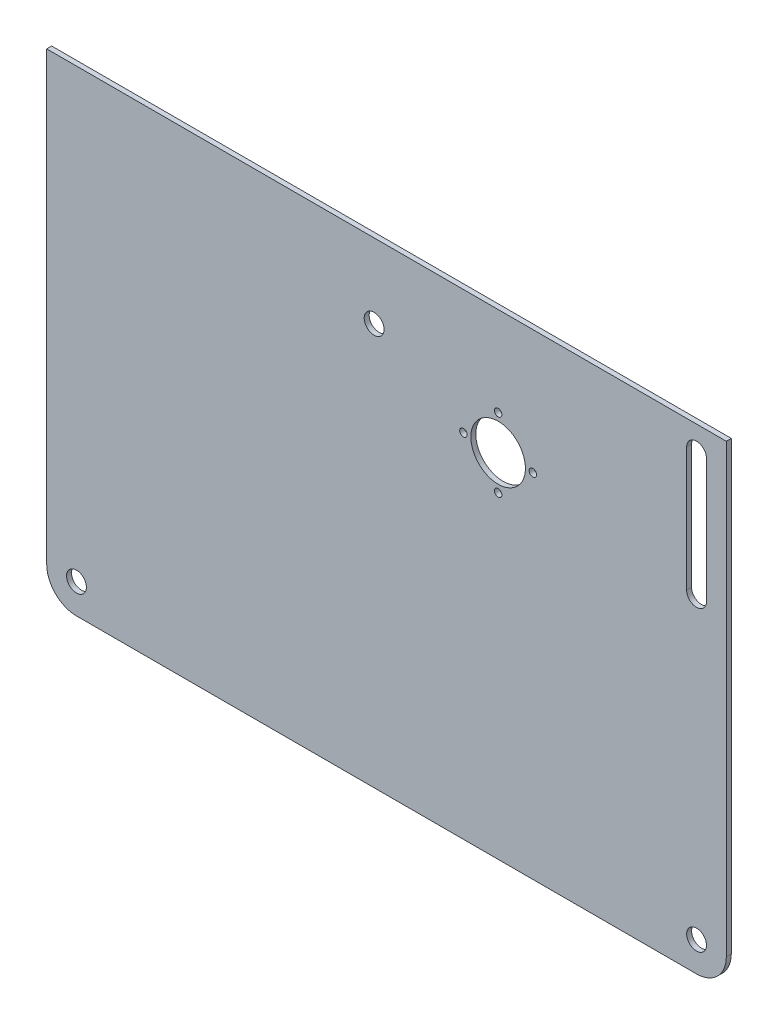
from build123d import *

# Parameters (mm, degrees)
SKETCH1_R           = 4
SKETCH1_R_2         = 1.5
SKETCH1_R_3         = 11
BOSS_EXTRUDE1_DEPTH = 2


with BuildPart() as part:
    # Sketch1 → Boss-Extrude1 (new body)
    with BuildSketch(Plane.XY):
        with BuildLine():
            ThreePointArc((-137, 0), (-133.485281374, -8.485281374), (-125, -12))
            Line((-125, -12), (125, -12))
            ThreePointArc((125, -12), (133.485281374, -8.485281374), (137, 0))
            Line((137, 0), (137, 180))
            Line((137, 180), (-53.998245329, 180))
            Line((-53.998245329, 180), (-137, 180))
            Line((-137, 180), (-137, 0))
        make_face()
        with Locations((-125, 0)):
            Circle(SKETCH1_R, mode=Mode.SUBTRACT)
        with Locations((125, 0)):
            Circle(SKETCH1_R, mode=Mode.SUBTRACT)
        with Locations((-5, 150)):
            Circle(SKETCH1_R, mode=Mode.SUBTRACT)
        with Locations((31, 130)):
            Circle(SKETCH1_R_2, mode=Mode.SUBTRACT)
        with Locations((45, 116)):
            Circle(SKETCH1_R_2, mode=Mode.SUBTRACT)
        with Locations((45, 130)):
            Circle(SKETCH1_R_3, mode=Mode.SUBTRACT)
        with Locations((59, 130)):
            Circle(SKETCH1_R_2, mode=Mode.SUBTRACT)
        with Locations((45, 144)):
            Circle(SKETCH1_R_2, mode=Mode.SUBTRACT)
        with BuildLine():
            ThreePointArc((129, 120), (125, 116), (121, 120))
            Line((121, 120), (121, 170))
            ThreePointArc((121, 170), (125, 174), (129, 170))
            Line((129, 170), (129, 120))
        make_face(mode=Mode.SUBTRACT)
    extrude(amount=BOSS_EXTRUDE1_DEPTH)


solid = part.part
